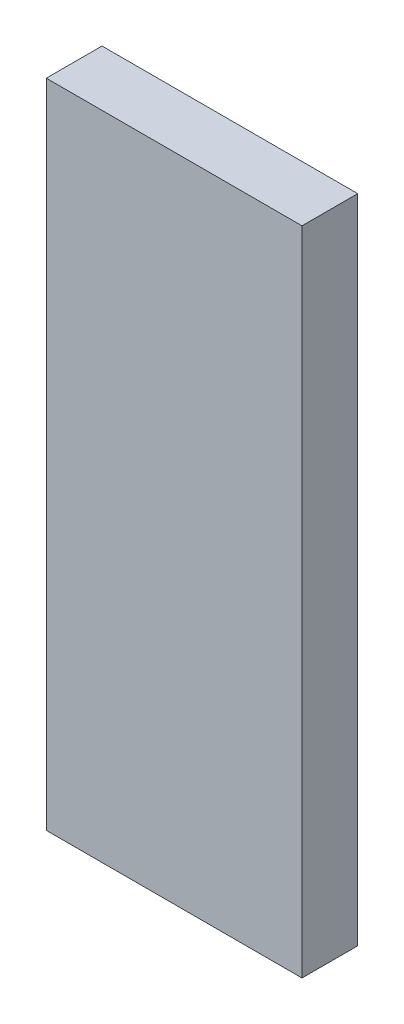
from build123d import *

# Parameters (mm, degrees)
SKETCH1_W           = 32.12
SKETCH1_H           = 81.827256637
BOSS_EXTRUDE1_DEPTH = 7


with BuildPart() as part:
    # Sketch1 → Boss-Extrude1 (new body)
    with BuildSketch(Plane.XY):
        with Locations((-5.658230088, -9.823893805)):
            Rectangle(SKETCH1_W, SKETCH1_H)
    extrude(amount=BOSS_EXTRUDE1_DEPTH)


solid = part.part
